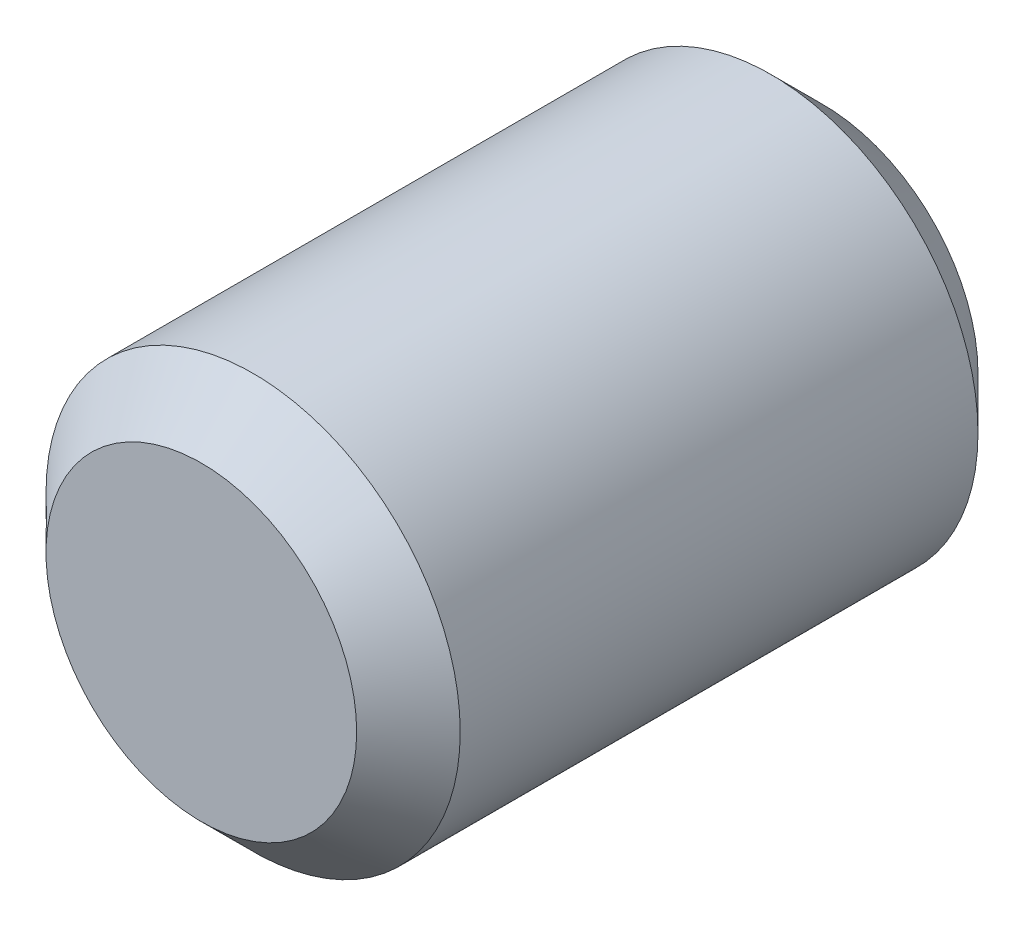
from build123d import *

# Parameters (mm, degrees)
SKETCH1_R           = 1
BOSS_EXTRUDE1_DEPTH = 1.5
CHAMFER1_SIZE       = 0.25


with BuildPart() as part:
    # Sketch1 → Boss-Extrude1 (new, symmetric)
    with BuildSketch(Plane.XY):
        Circle(SKETCH1_R)
    extrude(amount=BOSS_EXTRUDE1_DEPTH, both=True)

    # Chamfer1
    chamfer1_edges = [part.edges().sort_by_distance(p)[0] for p in [
        (-1, 0, -1.5),
        (-1, 0, 1.5),
    ]]
    chamfer(chamfer1_edges, length=CHAMFER1_SIZE)


solid = part.part
